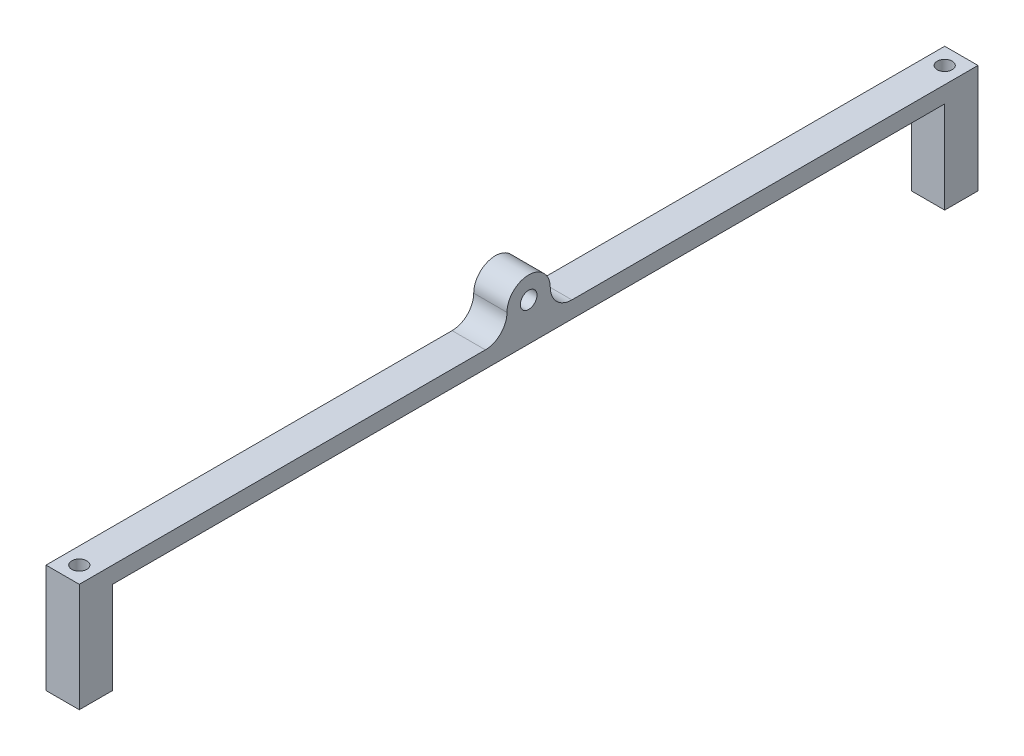
from build123d import *
from build123d.topology import SkipClean

# Parameters (mm, degrees)
SKETCH_1_W      = 10
SKETCH_1_H      = 270
SKETCH_1_R      = 2.25
EXTRUDE_1_DEPTH = 5
SKETCH_2_R      = 2.5
EXTRUDE_2_DEPTH = 10
EXTRUDE_START   = 27.65
SKETCH_3_W      = 10
SKETCH_3_H      = 10
SKETCH_3_R      = 2.25
EXTRUDE_3_DEPTH = 27.65


with BuildPart() as part:
    # Эскиз1 → Бобышка-Вытянуть1 (new body)
    with BuildSketch(Plane(origin=(0, 0, 0), x_dir=(1, 0, 0), z_dir=(0, 1, 0))):
        with Locations((5, 135)):
            Rectangle(SKETCH_1_W, SKETCH_1_H)
        with Locations(Location((5, 265, 0), (0, 0, 270))):
            Circle(SKETCH_1_R, mode=Mode.SUBTRACT)
        with Locations(Location((5, 5, 0), (0, 0, 270))):
            Circle(SKETCH_1_R, mode=Mode.SUBTRACT)
    extrude(amount=EXTRUDE_1_DEPTH)

    # Эскиз2 → Бобышка-Вытянуть2 (add)
    with BuildSketch(Plane(origin=(0, 0, 0), x_dir=(0, 0, -1), z_dir=(1, 0, 0))):
        with BuildLine():
            Line((122, 5), (148, 5))
            ThreePointArc((148, 5), (143.403805922, 6.903805922), (141.5, 11.5))
            ThreePointArc((141.5, 11.5), (135, 18), (128.5, 11.5))
            ThreePointArc((128.5, 11.5), (126.596194078, 6.903805922), (122, 5))
        make_face()
        with Locations((135, 11.5)):
            Circle(SKETCH_2_R, mode=Mode.SUBTRACT)
    extrude(amount=EXTRUDE_2_DEPTH)

    # Эскиз3 → Бобышка-Вытянуть3 (add)
    # profile 1 of 2: a face of its own
    with SkipClean():  # the faces are left unmerged after this step: merging them gives an invalid solid
        with BuildSketch(Plane.XZ.offset(EXTRUDE_START)):
            with Locations((5, -5)):
                Rectangle(SKETCH_3_W, SKETCH_3_H)
            with Locations(Location((5, -5, 0), (0, 0, 90))):
                Circle(SKETCH_3_R, mode=Mode.SUBTRACT)
        # profile 2 of 2: a face of its own
        with BuildSketch(Plane.XZ.offset(EXTRUDE_START)):
            with Locations((5, -265)):
                Rectangle(SKETCH_3_W, SKETCH_3_H)
            with Locations((5, -265)):
                Circle(SKETCH_3_R, mode=Mode.SUBTRACT)
        extrude(amount=-EXTRUDE_3_DEPTH)


solid = part.part
